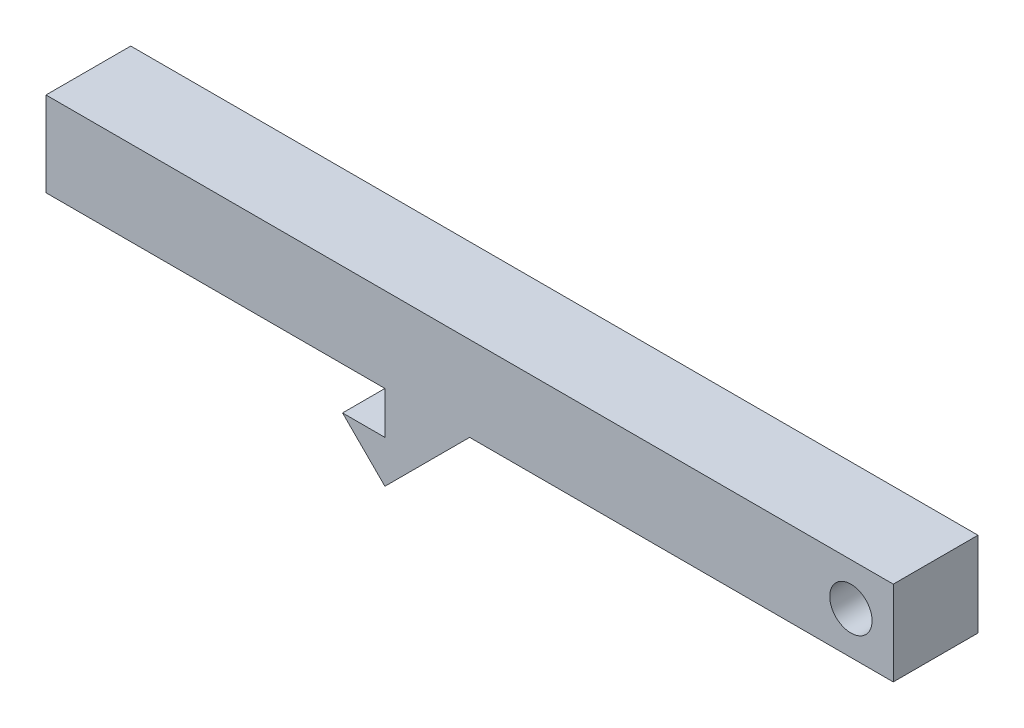
from build123d import *

# Parameters (mm, degrees)
SKETCH1_R           = 0.635
BOSS_EXTRUDE1_DEPTH = 2.54


with BuildPart() as part:
    # Sketch1 → Boss-Extrude1 (new body)
    with BuildSketch(Plane.XY):
        Polygon((10.16, -2.54), (12.7, 0), (25.4, 0), (25.4, 2.54), (0, 2.54), (0, 0), (10.16, 0), (10.16, -1.270178495), (8.890178495, -1.270178495), align=None)
        with Locations((24.13, 1.27)):
            Circle(SKETCH1_R, mode=Mode.SUBTRACT)
    extrude(amount=BOSS_EXTRUDE1_DEPTH)


solid = part.part
